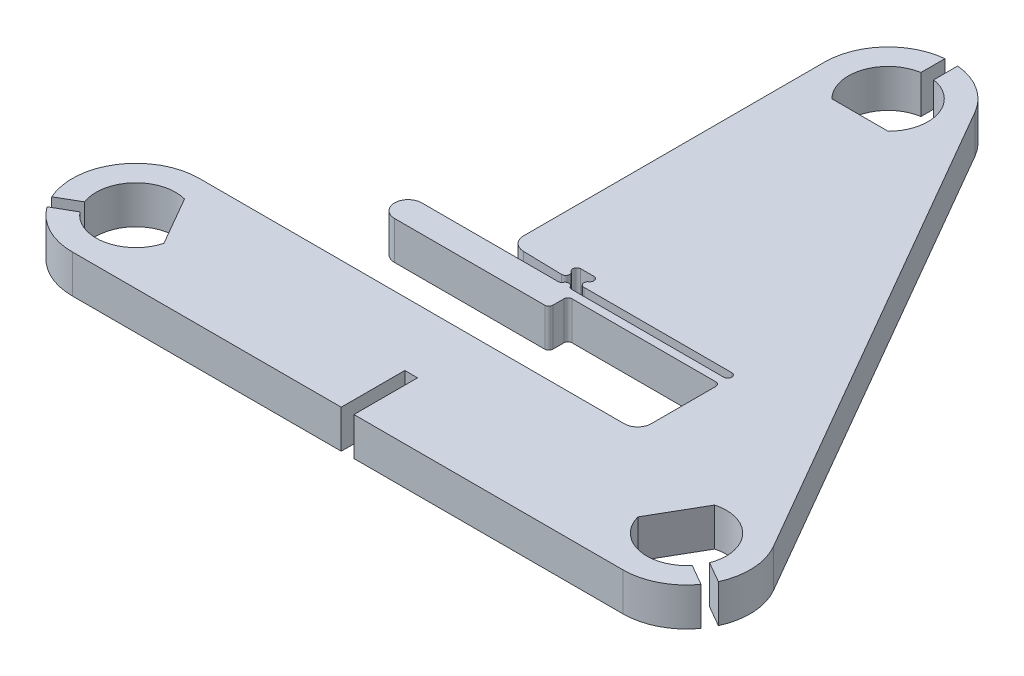
from build123d import *

# Parameters (mm, degrees)
BOSS_EXTRUDE1_DEPTH = 2.4


with BuildPart() as part:
    # Sketch1 → Boss-Extrude1 (new body)
    with BuildSketch(Plane(origin=(0, 0, 0), x_dir=(1, 0, 0), z_dir=(0, 1, 0))):
        with BuildLine():
            Line((-1.767766953, 18.232233047), (1.767766953, 18.232233047))
            ThreePointArc((1.767766953, 18.232233047), (2.379032248, 20.768248374), (0.4, 22.467792536))
            Line((0.4, 22.467792536), (0.4, 23.979949748))
            ThreePointArc((0.4, 23.979949748), (2.170914686, 23.359632335), (3.464101615, 22))
            Line((3.464101615, 22), (20.784609691, -8))
            ThreePointArc((20.784609691, -8), (21.315492368, -9.7997489), (20.967245664, -11.643564713))
            Line((20.967245664, -11.643564713), (19.657679103, -10.887486106))
            ThreePointArc((19.657679103, -10.887486106), (19.175346808, -8.323821824), (16.673460463, -7.585185434))
            Line((16.673460463, -7.585185434), (14.90569351, -10.647047613))
            ThreePointArc((14.90569351, -10.647047613), (16.79631456, -12.44442655), (19.257679103, -11.580306429))
            Line((19.257679103, -11.580306429), (20.567245664, -12.336385036))
            ThreePointArc((20.567245664, -12.336385036), (19.144577682, -13.559883435), (17.320508076, -14))
            Line((17.320508076, -14), (0.4, -14))
            Line((0.4, -14), (0.4, -10))
            Line((0.4, -10), (-0.4, -10))
            Line((-0.4, -10), (-0.4, -14))
            Line((-0.4, -14), (-17.320508076, -14))
            ThreePointArc((-17.320508076, -14), (-19.144577682, -13.559883435), (-20.567245664, -12.336385036))
            Line((-20.567245664, -12.336385036), (-19.257679103, -11.580306429))
            ThreePointArc((-19.257679103, -11.580306429), (-16.79631456, -12.44442655), (-14.90569351, -10.647047613))
            Line((-14.90569351, -10.647047613), (-16.673460463, -7.585185434))
            ThreePointArc((-16.673460463, -7.585185434), (-19.175346808, -8.323821824), (-19.657679103, -10.887486106))
            Line((-19.657679103, -10.887486106), (-20.967245664, -11.643564713))
            ThreePointArc((-20.967245664, -11.643564713), (-20.680140411, -7.829085314), (-17.320508076, -6))
            Line((-17.320508076, -6), (9.396838839, -6))
            ThreePointArc((9.396838839, -6), (10.000114881, -5.750114881), (10.25, -5.146838839))
            Line((10.25, -5.146838839), (10.25, -1.085))
            ThreePointArc((10.25, -1.085), (10.176776695, -0.908223305), (10, -0.835))
            Line((10, -0.835), (0.94831677, -0.835))
            ThreePointArc((0.94831677, -0.835), (0.771540074, -0.908223305), (0.69831677, -1.085))
            Line((0.69831677, -1.085), (0.69831677, -1.791322322))
            ThreePointArc((0.69831677, -1.791322322), (0.625093465, -1.968099017), (0.44831677, -2.041322322))
            Line((0.44831677, -2.041322322), (-9, -2.041322322))
            ThreePointArc((-9, -2.041322322), (-9.853161161, -1.188161161), (-9, -0.335))
            Line((-9, -0.335), (-0.433012702, -0.335))
            ThreePointArc((-0.433012702, -0.335), (-0.308012702, -0.301506351), (-0.216506351, -0.21))
            ThreePointArc((-0.216506351, -0.21), (0, -0.085), (0.216506351, -0.21))
            ThreePointArc((0.216506351, -0.21), (0.308012702, -0.301506351), (0.433012702, -0.335))
            Line((0.433012702, -0.335), (10, -0.335))
            ThreePointArc((10, -0.335), (10.25, -0.085), (10, 0.165))
            Line((10, 0.165), (0.69831677, 0.165))
            ThreePointArc((0.69831677, 0.165), (0.459762847, 0.340220149), (0.555604555, 0.620263791))
            ThreePointArc((0.555604555, 0.620263791), (0.651446263, 0.900307433), (0.412892341, 1.075527582))
            Line((0.412892341, 1.075527582), (-0.412892341, 1.075527582))
            ThreePointArc((-0.412892341, 1.075527582), (-0.651446263, 0.900307433), (-0.555604555, 0.620263791))
            ThreePointArc((-0.555604555, 0.620263791), (-0.460652433, 0.337439296), (-0.704155623, 0.165068194))
            Line((-0.704155623, 0.165068194), (-3.166764771, 0.222599142))
            ThreePointArc((-3.166764771, 0.222599142), (-3.757119102, 0.479338042), (-4, 1.075527582))
            Line((-4, 1.075527582), (-4, 20))
            ThreePointArc((-4, 20), (-2.966479395, 22.683281573), (-0.4, 23.979949748))
            Line((-0.4, 23.979949748), (-0.4, 22.467792536))
            ThreePointArc((-0.4, 22.467792536), (-2.379032248, 20.768248374), (-1.767766953, 18.232233047))
        make_face()
    extrude(amount=BOSS_EXTRUDE1_DEPTH)


solid = part.part
